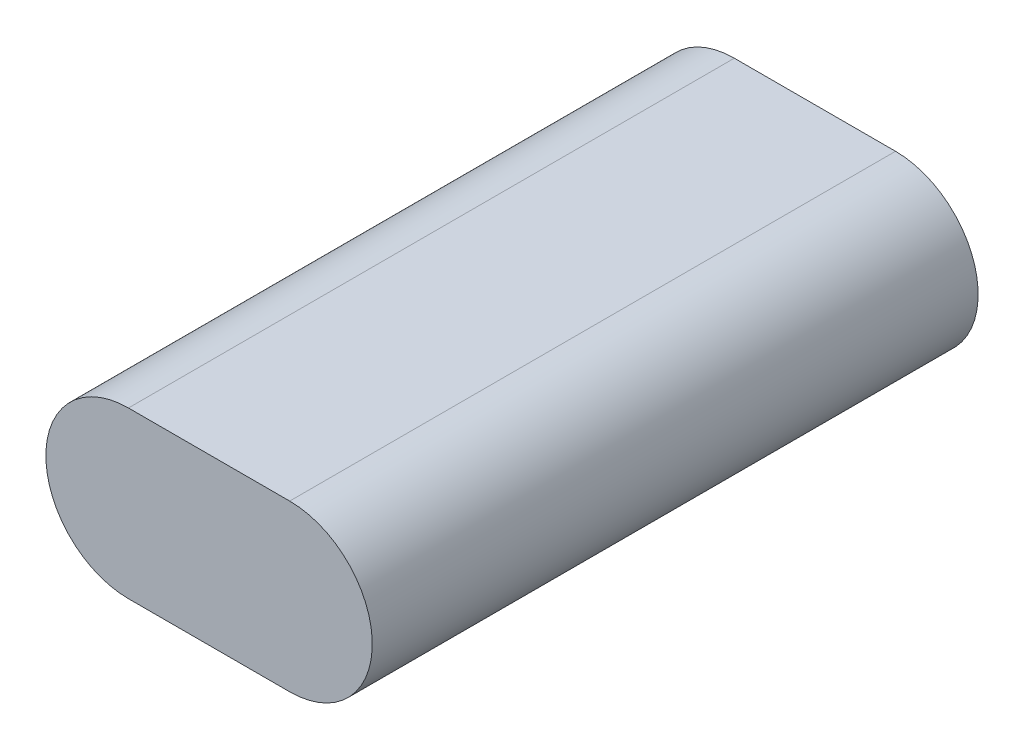
from build123d import *

# Parameters (mm, degrees)
EXTRUDE1_DEPTH = 122.5


with BuildPart() as part:
    # Sketch1 → Extrude1 (new body)
    with BuildSketch(Plane.XY):
        with BuildLine():
            Line((-16.3, 16.7), (16.3, 16.7))
            ThreePointArc((16.3, 16.7), (33, 0), (16.3, -16.7))
            Line((16.3, -16.7), (-16.3, -16.7))
            ThreePointArc((-16.3, -16.7), (-33, 0), (-16.3, 16.7))
        make_face()
    extrude(amount=-EXTRUDE1_DEPTH)


solid = part.part
